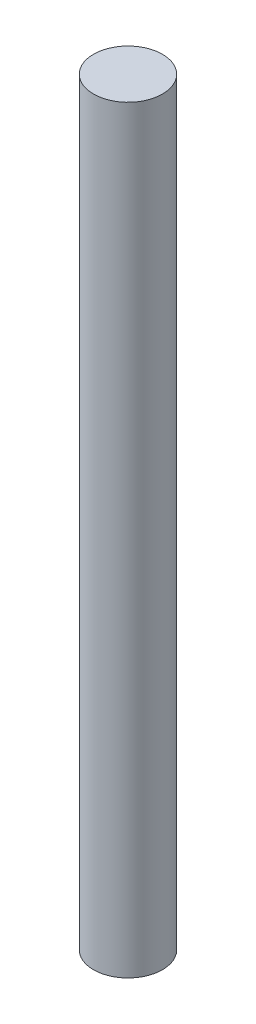
from build123d import *

# Parameters (mm, degrees)
SKETCH1_R           = 1.5
BOSS_EXTRUDE1_DEPTH = 16.5


with BuildPart() as part:
    # Sketch1 → Boss-Extrude1 (new, symmetric)
    with BuildSketch(Plane(origin=(0, 0, 0), x_dir=(1, 0, 0), z_dir=(0, 1, 0))):
        with Locations(Location((0, 0, 0), (0, 0, 270))):
            Circle(SKETCH1_R)
    extrude(amount=BOSS_EXTRUDE1_DEPTH, both=True)


solid = part.part
